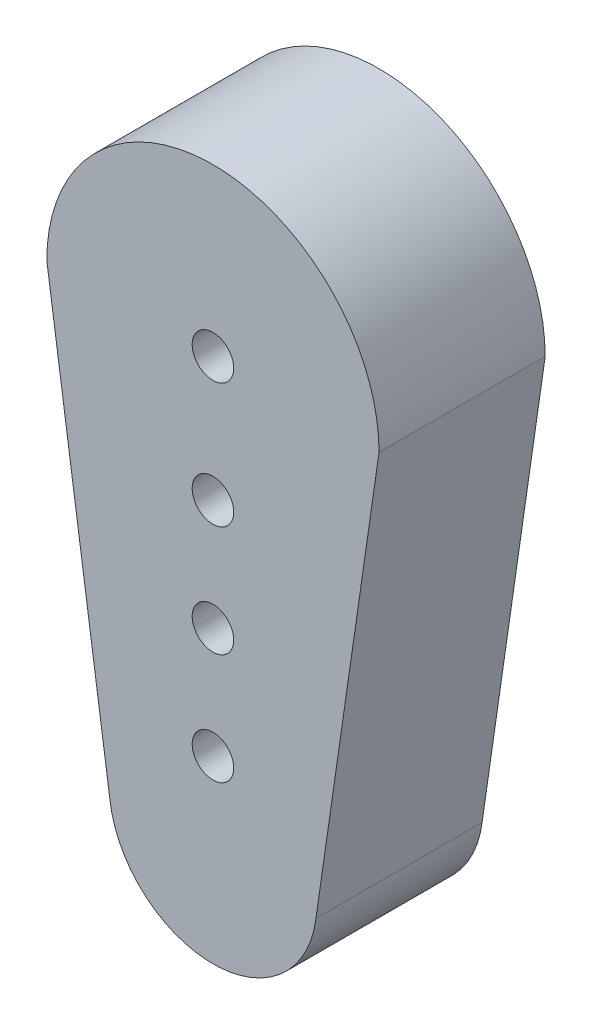
from build123d import *

# Parameters (mm, degrees)
BOSS_EXTRUDE1_DEPTH     = 6
CUT_EXTRUDE3_DEPTH      = 4.7
CUT_EXTRUDE4_DEPTH      = 21.471687766
CUT_EXTRUDE4_DEPTH_BACK = 21.471687766
SKETCH4_R               = 0.75
SKETCH6_R               = 0.75
CUT_EXTRUDE6_DEPTH      = 21.471687766
LPATTERN1_COUNT         = 3
LPATTERN1_PITCH         = 4
SCALE1_SCALE            = 1.02


with BuildPart() as part:
    # Sketch2 → Boss-Extrude1 (new body)
    with BuildSketch(Plane.XY):
        with BuildLine():
            Line((-6, 0), (-3.720572803, -15.718868867))
            ThreePointArc((-3.720572803, -15.718868867), (-5.969e-06, -19), (3.720571311, -15.71888071))
            Line((3.720571311, -15.71888071), (6, 0))
            ThreePointArc((6, 0), (0, 6), (-6, 0))
        make_face()
    extrude(amount=BOSS_EXTRUDE1_DEPTH)

    # Sketch3 → Cut-Extrude3 (cut)
    with BuildSketch(Plane.XY):
        with BuildLine():
            Line((-3.75, 0), (-2.25, -15))
            ThreePointArc((-2.25, -15), (0, -17.25), (2.25, -15))
            Line((2.25, -15), (3.75, 0))
            ThreePointArc((3.75, 0), (0, 3.75), (-3.75, 0))
        make_face()
    extrude(amount=CUT_EXTRUDE3_DEPTH, mode=Mode.SUBTRACT)

    # Sketch4 → Cut-Extrude4 (cut, two sides: drawn at the far end of the back side and taken through both)
    with BuildSketch(Plane(origin=(0, 0, 4.7), x_dir=(-1, 0, 0), z_dir=(0, 0, -1)).offset(-CUT_EXTRUDE4_DEPTH_BACK)):
        Circle(SKETCH4_R)
    extrude(amount=CUT_EXTRUDE4_DEPTH + CUT_EXTRUDE4_DEPTH_BACK, mode=Mode.SUBTRACT)

    # Sketch6 → Cut-Extrude6 (cut, symmetric)
    with BuildSketch(Plane(origin=(0, 0, 4.7), x_dir=(-1, 0, 0), z_dir=(0, 0, -1))):
        with Locations((0, -4.5)):
            Circle(SKETCH6_R)
    cut_extrude6 = extrude(amount=CUT_EXTRUDE6_DEPTH, both=True, mode=Mode.SUBTRACT)

    # LPattern1: Cut-Extrude6 ×3
    with Locations(*[(0, -i * LPATTERN1_PITCH, 0) for i in range(1, LPATTERN1_COUNT)]):
        add(cut_extrude6, mode=Mode.SUBTRACT)


with BuildPart() as part_1:
    # Scale1: scaled about (6e-08, -5.397561761, 3.434577722)
    add(part.part.scale(SCALE1_SCALE).moved(Location((-1e-09, 0.107951235, -0.068691554))))


solid = part_1.part
